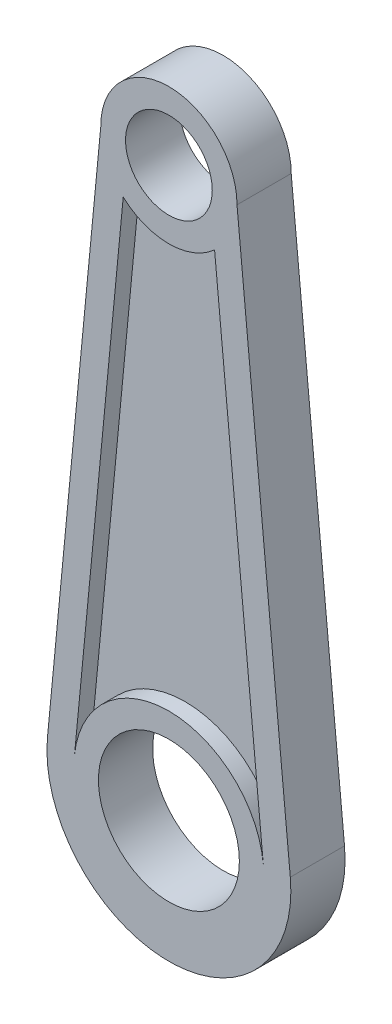
from build123d import *

# Parameters (mm, degrees)
BOSS_EXTRUDE1_DEPTH = 10
CUT_EXTRUDE1_DEPTH  = 3
CUT_EXTRUDE2_START  = -3
CUT_EXTRUDE2_DEPTH  = 3
SKETCH8_R           = 17.5
SKETCH8_R_2         = 12.562549016
BOSS_EXTRUDE3_DEPTH = 10
SKETCH9_R           = 13
SKETCH9_R_2         = 8
CUT_EXTRUDE4_DEPTH  = 120.823194953


with BuildPart() as part:
    # Sketch2 → Boss-Extrude1 (new body)
    with BuildSketch(Plane.XY):
        with BuildLine():
            Line((-12.442858632, 105.897439267), (-22.397145538, 2.148923391))
            ThreePointArc((-22.397145538, 2.148923391), (0, -22.5), (22.397145538, 2.148923391))
            Line((22.397145538, 2.148923391), (12.442858632, 105.897439267))
            ThreePointArc((12.442858632, 105.897439267), (0, 117.203592938), (-12.442858632, 105.897439267))
        make_face()
    extrude(amount=BOSS_EXTRUDE1_DEPTH)

    # Sketch3 → Cut-Extrude1 (cut)
    with BuildSketch(Plane.XY.offset(10)):
        with BuildLine():
            Line((-7.465715179, 105.419900735), (-17.420002085, 1.67138486))
            ThreePointArc((-17.420002085, 1.67138486), (0, -17.5), (17.420002085, 1.67138486))
            Line((17.420002085, 1.67138486), (7.465715179, 105.419900735))
            ThreePointArc((7.465715179, 105.419900735), (0, 112.203592938), (-7.465715179, 105.419900735))
        make_face()
    extrude(amount=-CUT_EXTRUDE1_DEPTH, mode=Mode.SUBTRACT)

    # Sketch5 → Cut-Extrude2 (cut)
    with BuildSketch(Plane(origin=(0, 0, 0), x_dir=(-1, 0, 0), z_dir=(0, 0, -1)).offset(CUT_EXTRUDE2_START)):
        with BuildLine():
            Line((-7.465715179, 105.419900735), (-17.420002085, 1.67138486))
            ThreePointArc((-17.420002085, 1.67138486), (0, -17.5), (17.420002085, 1.67138486))
            Line((17.420002085, 1.67138486), (7.465715179, 105.419900735))
            ThreePointArc((7.465715179, 105.419900735), (0, 112.203592938), (-7.465715179, 105.419900735))
        make_face()
    extrude(amount=CUT_EXTRUDE2_DEPTH, mode=Mode.SUBTRACT)

    # Sketch8 → Boss-Extrude3 (add)
    with BuildSketch(Plane.XY):
        Circle(SKETCH8_R)
        with Locations((0, 104.703592938)):
            Circle(SKETCH8_R_2)
    extrude(amount=BOSS_EXTRUDE3_DEPTH)

    # Sketch9 → Cut-Extrude4 (cut, through all)
    with BuildSketch(Plane.XY.offset(10)):
        Circle(SKETCH9_R)
        with Locations((0, 104.703592938)):
            Circle(SKETCH9_R_2)
    extrude(amount=-CUT_EXTRUDE4_DEPTH, mode=Mode.SUBTRACT)


solid = part.part
